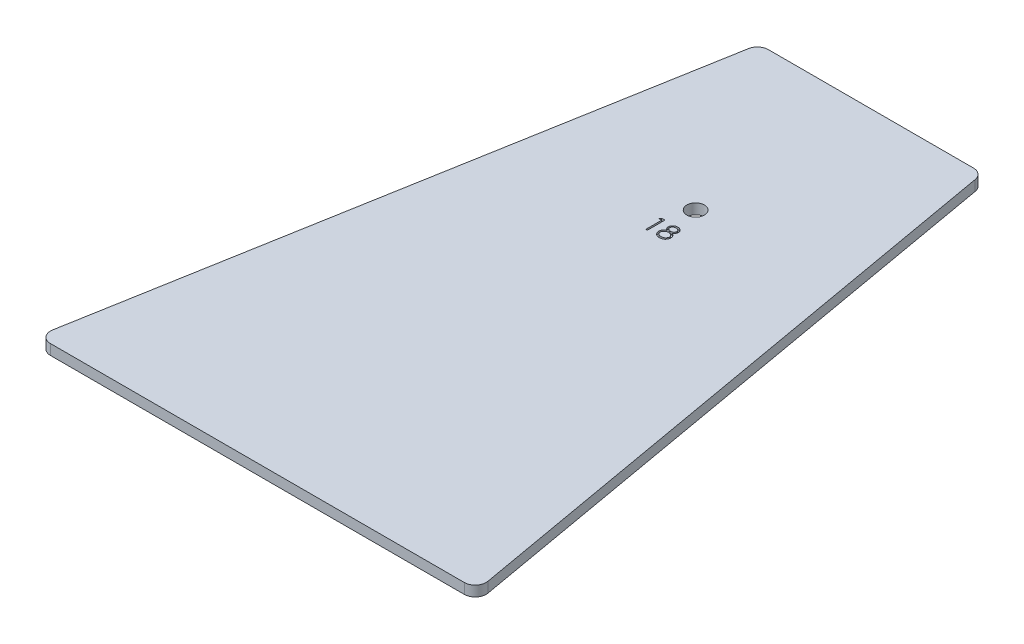
from build123d import *

# Parameters (mm, degrees)
BOSS_EXTRUDE1_DEPTH = 5.9944
SKETCH2_R           = 5.08
CUT_EXTRUDE1_DEPTH  = 378.804673845
CUT_EXTRUDE2_DEPTH  = 1.27
FILLET1_R           = 6.35


with BuildPart() as part:
    # Sketch1 → Boss-Extrude1 (new body)
    with BuildSketch(Plane(origin=(0, 0, 0), x_dir=(1, 0, 0), z_dir=(0, 1, 0))):
        Polygon((-64.77, 0), (64.77, 0), (127.47187434, -355.6), (-127.47187434, -355.6), align=None)
    extrude(amount=BOSS_EXTRUDE1_DEPTH)

    # Sketch2 → Cut-Extrude1 (cut, through all)
    with BuildSketch(Plane(origin=(0, 5.9944, 0), x_dir=(1, 0, 0), z_dir=(0, 1, 0))):
        with Locations(Location((0, -101.6, 0), (0, 0, 270))):
            Circle(SKETCH2_R)
    extrude(amount=-CUT_EXTRUDE1_DEPTH, mode=Mode.SUBTRACT)

    # Sketch3 → Cut-Extrude2 (cut)
    # profile 1 of 2: a face of its own
    with BuildSketch(Plane(origin=(0, 5.9944, 0), x_dir=(1, 0, 0), z_dir=(0, 1, 0))):
        Polygon((-5.704823718, -115.57), (-3.826282051, -115.57), (-3.826282051, -125.73), (-4.738076923, -125.73), (-4.738076923, -116.612051282), (-6.301153846, -116.612051282), align=None)
    # profile 2 of 2: a face of its own
    with BuildSketch(Plane(origin=(0, 5.9944, 0), x_dir=(1, 0, 0), z_dir=(0, 1, 0))):
        with BuildLine():
            add(Edge.make_bspline(
                [(4.890721154, -120.069951923), (4.973883794, -120.113314675), (5.136078715, -120.197886524), (5.367079982, -120.334061955), (5.578190271, -120.477582013), (5.775266873, -120.621667822), (5.954847343, -120.771837416), (6.114923696, -120.928687949), (6.259450044, -121.088304293), (6.385511794, -121.253389315), (6.496391754, -121.423504433), (6.592221267, -121.599096152), (6.674131776, -121.779779658), (6.739048192, -121.967527256), (6.792524022, -122.159581044), (6.829319492, -122.3584209), (6.849108031, -122.562736586), (6.852849272, -122.700820571), (6.85474359, -122.770737179)],
                knots=[0, 0, 0, 0, 1.272397273, 2.481599622, 3.635517121, 4.734568067, 5.792894095, 6.808321871, 7.773003508, 8.711915296, 9.623354172, 10.525449501, 11.423591555, 12.311487226, 13.218079475, 14.126165749, 15.051214107, 16, 16, 16, 16], degree=3))
            add(Edge.make_bspline(
                [(6.85474359, -122.770737179), (6.852504266, -122.868556883), (6.848071804, -123.062178781), (6.809463851, -123.347953779), (6.751659319, -123.625501123), (6.667245649, -123.894759965), (6.557769063, -124.154244546), (6.422853448, -124.404176985), (6.270130635, -124.648653608), (6.147478421, -124.799077928), (6.085416667, -124.875192308)],
                knots=[0, 0, 0, 0, 1.025265484, 2.029385089, 3.018602448, 3.995076438, 4.983346944, 5.966715145, 6.97116228, 8, 8, 8, 8], degree=3))
            add(Edge.make_bspline(
                [(6.085416667, -124.875192308), (6.004611358, -124.964001664), (5.843999275, -125.140522934), (5.568857977, -125.369705856), (5.266897309, -125.562308669), (4.939285692, -125.719271654), (4.58689886, -125.84144089), (4.209811898, -125.9292306), (3.807289671, -125.979515137), (3.530631504, -125.986783861), (3.388701923, -125.990512821)],
                knots=[0, 0, 0, 0, 0.954267603, 1.896743057, 2.838368354, 3.796610408, 4.779680527, 5.799409237, 6.871065594, 8, 8, 8, 8], degree=3))
            add(Edge.make_bspline(
                [(3.388701923, -125.990512821), (3.252228772, -125.987167342), (2.986665882, -125.98065738), (2.600127586, -125.936550115), (2.239816046, -125.859253222), (1.903636253, -125.753459728), (1.593614903, -125.615834608), (1.310635386, -125.444541627), (1.050614941, -125.246475498), (0.821444607, -125.015947774), (0.617987867, -124.769036922), (0.439264604, -124.514306534), (0.290713565, -124.251733359), (0.164941196, -123.985232591), (0.068659165, -123.711068897), (0.00197412, -123.430652859), (-0.040376574, -123.144474273), (-0.046011412, -122.951342388), (-0.048846154, -122.854182692)],
                knots=[0, 0, 0, 0, 1.256902934, 2.445805442, 3.576955095, 4.645999104, 5.686449165, 6.692658513, 7.68621702, 8.689161843, 9.678783111, 10.630372946, 11.551080876, 12.453998257, 13.34127905, 14.221779781, 15.105423033, 16, 16, 16, 16], degree=3))
            add(Edge.make_bspline(
                [(-0.048846154, -122.854182692), (-0.047168648, -122.782890866), (-0.043853304, -122.641993055), (-0.020906659, -122.433831119), (0.015984189, -122.231222911), (0.066085927, -122.033420066), (0.133986735, -121.841862635), (0.215969613, -121.655642974), (0.311566366, -121.474550847), (0.422110548, -121.297595924), (0.550712995, -121.127257683), (0.696330904, -120.96064531), (0.86187466, -120.800344118), (1.045502607, -120.644395593), (1.245116242, -120.490033338), (1.465900387, -120.345599566), (1.702002147, -120.200869017), (1.869802982, -120.114339706), (1.95588141, -120.069951923)],
                knots=[0, 0, 0, 0, 0.941657376, 1.861047343, 2.762797495, 3.66048619, 4.553285746, 5.444104102, 6.34607688, 7.256116206, 8.197091036, 9.162375105, 10.176350973, 11.237807142, 12.343728897, 13.50695164, 14.721116704, 16, 16, 16, 16], degree=3))
            add(Edge.make_bspline(
                [(1.95588141, -120.069951923), (1.838050448, -120.005697852), (1.609896725, -119.881283985), (1.307798005, -119.652693257), (1.048309795, -119.405114914), (0.838564672, -119.133320996), (0.673472718, -118.845802069), (0.560207283, -118.544357039), (0.483582061, -118.234575407), (0.475991592, -118.022939134), (0.472179487, -117.916650641)],
                knots=[0, 0, 0, 0, 1.166880483, 2.259407225, 3.286803203, 4.280235371, 5.237608625, 6.161067461, 7.076446754, 8, 8, 8, 8], degree=3))
            add(Edge.make_bspline(
                [(0.472179487, -117.916650641), (0.47692689, -117.808381157), (0.486469997, -117.590740613), (0.563637579, -117.266763981), (0.689389543, -116.948562752), (0.86042878, -116.637679197), (1.073461385, -116.344635145), (1.329047929, -116.081807713), (1.621084928, -115.851577809), (1.948114622, -115.658316691), (2.300046095, -115.50102927), (2.671367168, -115.392525048), (3.055608188, -115.321590492), (3.317148996, -115.313559289), (3.449759615, -115.309487179)],
                knots=[0, 0, 0, 0, 0.888701115, 1.786444228, 2.72001202, 3.692817113, 4.693886446, 5.687152267, 6.695133018, 7.739871481, 8.800368666, 9.853104506, 10.91144658, 12, 12, 12, 12], degree=3))
            add(Edge.make_bspline(
                [(3.449759615, -115.309487179), (3.578947833, -115.313685707), (3.833692279, -115.321964725), (4.208145256, -115.391014634), (4.566430043, -115.506343754), (4.907311102, -115.662799693), (5.224685895, -115.855511499), (5.505108598, -116.08890375), (5.752816893, -116.350571795), (5.957713306, -116.643526986), (6.126551865, -116.95321596), (6.244120195, -117.277240192), (6.319455068, -117.608598603), (6.328957177, -117.832809494), (6.333717949, -117.945144231)],
                knots=[0, 0, 0, 0, 1.072916533, 2.115669174, 3.151510826, 4.193348718, 5.225979165, 6.227137561, 7.216255879, 8.211077061, 9.189680878, 10.138522389, 11.067357538, 12, 12, 12, 12], degree=3))
            add(Edge.make_bspline(
                [(6.333717949, -117.945144231), (6.329553624, -118.055385061), (6.321375127, -118.271891785), (6.252577589, -118.587509342), (6.136714941, -118.883084175), (5.978526171, -119.16197023), (5.772349327, -119.419109663), (5.520936548, -119.65777233), (5.226292257, -119.87991878), (5.004917798, -120.005282626), (4.890721154, -120.069951923)],
                knots=[0, 0, 0, 0, 0.975232327, 1.915300861, 2.843280834, 3.77672583, 4.742871857, 5.749627742, 6.839139064, 8, 8, 8, 8], degree=3))
        make_face()
        with BuildLine():
            add(Edge.make_bspline(
                [(3.398878205, -116.351538462), (3.327610723, -116.3534295), (3.188180366, -116.357129199), (2.983735995, -116.376458271), (2.78932478, -116.414059609), (2.602915485, -116.464101126), (2.427063847, -116.531702829), (2.259381597, -116.611226627), (2.102722555, -116.707909377), (1.955195572, -116.816363597), (1.82238761, -116.935650433), (1.704518397, -117.059932543), (1.6066105, -117.191650824), (1.52346945, -117.327528805), (1.463143674, -117.471599278), (1.417962723, -117.619445207), (1.387420627, -117.772934893), (1.385132043, -117.877834021), (1.383974359, -117.930897436)],
                knots=[0, 0, 0, 0, 1.203892937, 2.355340988, 3.463153438, 4.544400666, 5.610487187, 6.640501085, 7.674077295, 8.714426146, 9.728707835, 10.68524104, 11.601827946, 12.495867327, 13.368432065, 14.231010473, 15.105153427, 16, 16, 16, 16], degree=3))
            add(Edge.make_bspline(
                [(1.383974359, -117.930897436), (1.385969687, -117.983963144), (1.389912742, -118.088828605), (1.420407628, -118.243684033), (1.46585724, -118.395856556), (1.537414589, -118.541727772), (1.623241503, -118.686357866), (1.729171045, -118.826132139), (1.855413481, -118.961537027), (1.997733136, -119.091420845), (2.1527792, -119.213046969), (2.317034594, -119.318633119), (2.488437833, -119.406978994), (2.665227839, -119.480506637), (2.849206418, -119.537663712), (3.039246238, -119.578212698), (3.235379239, -119.603415294), (3.368273725, -119.606425619), (3.435512821, -119.607948718)],
                knots=[0, 0, 0, 0, 0.873023192, 1.725219244, 2.590779336, 3.480155217, 4.391973325, 5.357036234, 6.360879153, 7.436073238, 8.526419356, 9.601555421, 10.645666583, 11.697338044, 12.750135903, 13.812665442, 14.89329948, 16, 16, 16, 16], degree=3))
            add(Edge.make_bspline(
                [(3.435512821, -119.607948718), (3.521873122, -119.605414909), (3.693740749, -119.600372318), (3.94710018, -119.553487768), (4.193444314, -119.479738019), (4.430140105, -119.378834802), (4.651060844, -119.252189358), (4.84799087, -119.100564368), (5.019250422, -118.927460909), (5.163059736, -118.73557382), (5.274558033, -118.531353209), (5.36135871, -118.326410645), (5.412046123, -118.118559597), (5.418657575, -117.979318354), (5.421923077, -117.910544872)],
                knots=[0, 0, 0, 0, 1.076279235, 2.141928126, 3.20205304, 4.278698113, 5.344010996, 6.36967002, 7.368914609, 8.37248503, 9.349703398, 10.264243087, 11.142681841, 12, 12, 12, 12], degree=3))
            add(Edge.make_bspline(
                [(5.421923077, -117.910544872), (5.420379054, -117.862276059), (5.417314391, -117.766469384), (5.392059371, -117.624988872), (5.350328381, -117.486726995), (5.29382984, -117.350541569), (5.219488265, -117.21834333), (5.131345366, -117.088054137), (5.024274928, -116.962604949), (4.904106996, -116.839072271), (4.767831181, -116.724746076), (4.61571011, -116.62420646), (4.44852368, -116.538826591), (4.266267939, -116.469480949), (4.069614103, -116.417396871), (3.85946793, -116.378393073), (3.634077192, -116.356409412), (3.478978258, -116.353197327), (3.398878205, -116.351538462)],
                knots=[0, 0, 0, 0, 0.814439003, 1.616544685, 2.417341072, 3.248991801, 4.09997495, 4.973547432, 5.9003056, 6.880240646, 7.880314356, 8.896779544, 9.951930927, 11.043077905, 12.18215768, 13.381699519, 14.647792085, 16, 16, 16, 16], degree=3))
        make_face(mode=Mode.SUBTRACT)
        with BuildLine():
            add(Edge.make_bspline(
                [(3.457900641, -120.65), (3.367546932, -120.651607142), (3.190295002, -120.654759962), (2.930614319, -120.689854055), (2.681394844, -120.738707378), (2.443476857, -120.812819755), (2.216960828, -120.909184424), (2.000620515, -121.025108689), (1.79611095, -121.162139347), (1.606256179, -121.318535465), (1.432887885, -121.487073765), (1.280783106, -121.665489563), (1.151613161, -121.850466973), (1.047594352, -122.044355273), (0.962216296, -122.243048909), (0.906150869, -122.4514961), (0.87020853, -122.665689548), (0.865382148, -122.811297148), (0.862948718, -122.884711538)],
                knots=[0, 0, 0, 0, 1.140299081, 2.23698856, 3.303958914, 4.344563908, 5.37730929, 6.408454204, 7.439741482, 8.480804886, 9.510774543, 10.48932336, 11.43758569, 12.353841022, 13.263987381, 14.161954604, 15.073269652, 16, 16, 16, 16], degree=3))
            add(Edge.make_bspline(
                [(0.862948718, -122.884711538), (0.866906063, -122.975950969), (0.874757344, -123.156967867), (0.937042902, -123.424504097), (1.037004342, -123.683500073), (1.176414683, -123.93184517), (1.349040551, -124.163928907), (1.561316241, -124.366225467), (1.800049644, -124.545974674), (2.073318386, -124.691351308), (2.371814733, -124.807450658), (2.695459295, -124.887441682), (3.039607287, -124.940394005), (3.277233989, -124.945729982), (3.398878205, -124.948461538)],
                knots=[0, 0, 0, 0, 0.898778495, 1.783155532, 2.693654817, 3.627872908, 4.583023416, 5.533784346, 6.509005473, 7.520592997, 8.575161974, 9.658835044, 10.801527049, 12, 12, 12, 12], degree=3))
            add(Edge.make_bspline(
                [(3.398878205, -124.948461538), (3.493947845, -124.946636197), (3.679173989, -124.943079848), (3.9493892, -124.911687496), (4.204389376, -124.861904586), (4.443680014, -124.789497036), (4.669939846, -124.701105104), (4.879332668, -124.587394147), (5.077245192, -124.458065118), (5.253925045, -124.304625441), (5.414839731, -124.140673536), (5.555144375, -123.967111582), (5.676941152, -123.788656604), (5.772535012, -123.601275768), (5.848956366, -123.408564039), (5.903888742, -123.208744384), (5.937783127, -123.001203936), (5.941211098, -122.860418061), (5.942948718, -122.789054487)],
                knots=[0, 0, 0, 0, 1.224942928, 2.386581632, 3.501229538, 4.569074225, 5.605009692, 6.626002462, 7.634866581, 8.645888296, 9.63523824, 10.59253846, 11.518950513, 12.414518923, 13.29783783, 14.186679152, 15.080837789, 16, 16, 16, 16], degree=3))
            add(Edge.make_bspline(
                [(5.942948718, -122.789054487), (5.940319169, -122.719741979), (5.935134158, -122.583069819), (5.902225362, -122.380547559), (5.844412416, -122.184886818), (5.765084887, -121.993733658), (5.65947615, -121.810961207), (5.535103613, -121.631807978), (5.385042971, -121.461246413), (5.215479549, -121.297951712), (5.030686681, -121.146957459), (4.834258626, -121.013384117), (4.627707387, -120.90089226), (4.411470044, -120.809404376), (4.186026738, -120.737449893), (3.95154329, -120.687184032), (3.707745164, -120.655544042), (3.542123025, -120.651868892), (3.457900641, -120.65)],
                knots=[0, 0, 0, 0, 0.917430815, 1.809013306, 2.70690318, 3.612392954, 4.541220862, 5.495268465, 6.494511384, 7.542276156, 8.608045339, 9.649016899, 10.681629292, 11.715607085, 12.752076957, 13.808767841, 14.885711793, 16, 16, 16, 16], degree=3))
        make_face(mode=Mode.SUBTRACT)
    extrude(amount=-CUT_EXTRUDE2_DEPTH, mode=Mode.SUBTRACT)

    # Fillet1
    fillet1_edges = [part.edges().sort_by_distance(p)[0] for p in [
        (127.47187434, 2.9972, 355.6),
        (-127.47187434, 2.9972, 355.6),
        (-64.77, 2.9972, 0),
        (64.77, 2.9972, 0),
    ]]
    fillet(fillet1_edges, radius=FILLET1_R)


solid = part.part
